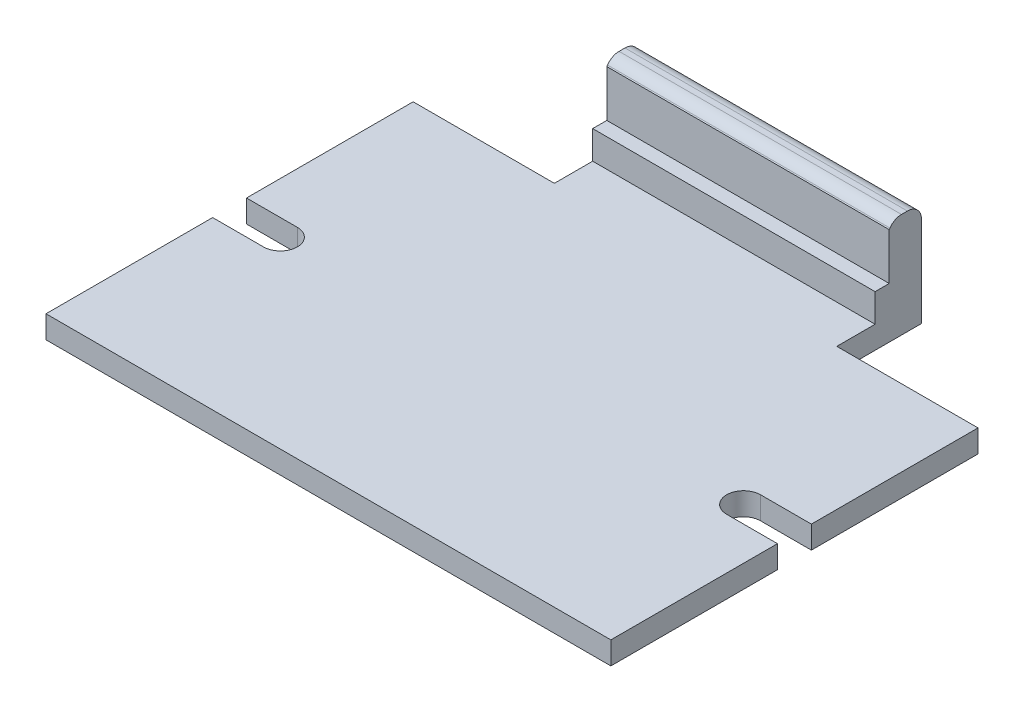
from build123d import *

# Parameters (mm, degrees)
EXTRUDE_1_DEPTH     = 200
SKETCH_2_W          = 50
SKETCH_2_H          = 30
CUT_EXTRUDE_1_DEPTH = 52
CUT_EXTRUDE_2_DEPTH = 10
CUT_EXTRUDE_4_DEPTH = 105.198677084


with BuildPart() as part:
    # Эскиз1 → Бобышка-Вытянуть1 (new body)
    with BuildSketch(Plane(origin=(0, 0, 0), x_dir=(0, 0, -1), z_dir=(1, 0, 0))):
        with BuildLine():
            Line((-80.986257223, 0), (79.013742777, 0))
            Line((79.013742777, 0), (79.013742777, 32))
            ThreePointArc((79.013742777, 32), (77.549276683, 35.535533906), (74.013742777, 37))
            Line((74.013742777, 37), (71.922596638, 37))
            ThreePointArc((71.922596638, 37), (69.613853571, 36.435054166), (67.826836416, 34.867882182))
            Line((67.826836416, 34.867882182), (49.013742777, 8))
            Line((49.013742777, 8), (-80.986257223, 8))
            Line((-80.986257223, 8), (-80.986257223, 0))
        make_face()
    extrude(amount=EXTRUDE_1_DEPTH)

    # Эскиз2 → Вырез-Вытянуть1 (cut)
    with BuildSketch(Plane.XZ):
        with Locations((25, -64.013742777)):
            Rectangle(SKETCH_2_W, SKETCH_2_H)
        with Locations((175, -64.013742777)):
            Rectangle(SKETCH_2_W, SKETCH_2_H)
    extrude(amount=-CUT_EXTRUDE_1_DEPTH, mode=Mode.SUBTRACT)

    # Эскиз3 → Вырез-Вытянуть2 (cut)
    with BuildSketch(Plane.XZ):
        with BuildLine():
            Line((18, 9.986257223), (0, 9.986257223))
            ThreePointArc((0, 9.986257223), (-6, 15.986257223), (0, 21.986257223))
            Line((0, 21.986257223), (18, 21.986257223))
            ThreePointArc((18, 21.986257223), (24, 15.986257223), (18, 9.986257223))
        make_face()
        with BuildLine():
            Line((182, 9.986257223), (200, 9.986257223))
            ThreePointArc((200, 9.986257223), (206, 15.986257223), (200, 21.986257223))
            Line((200, 21.986257223), (182, 21.986257223))
            ThreePointArc((182, 21.986257223), (176, 15.986257223), (182, 9.986257223))
        make_face()
    extrude(amount=-CUT_EXTRUDE_2_DEPTH, mode=Mode.SUBTRACT)

    # Эскиз4 → Вырез-Вытянуть4 (cut)
    with BuildSketch(Plane(origin=(150, 0, 0), x_dir=(0, 0, -1), z_dir=(1, 0, 0))):
        Polygon((67.577347999, 37), (67.577347999, 18), (62.577347999, 18), (62.577347999, 8), (49.013742777, 8), (49.013742777, 37), align=None)
    extrude(amount=-CUT_EXTRUDE_4_DEPTH, mode=Mode.SUBTRACT)


solid = part.part
